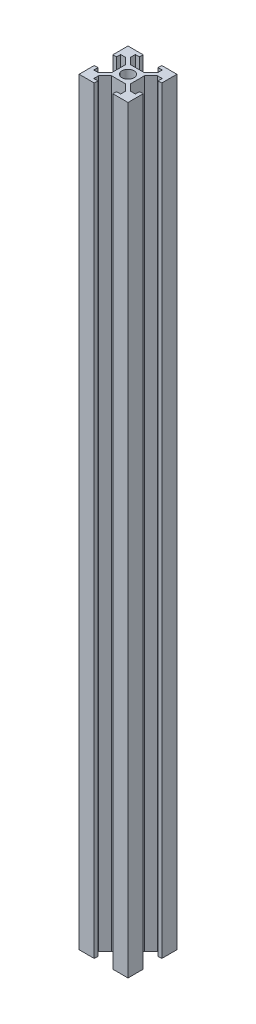
from build123d import *

# Parameters (mm, degrees)
SKETCH_1_W      = 1.5
SKETCH_1_H      = 1.7
SKETCH_1_W_2    = 1.7
SKETCH_1_H_2    = 1.5
SKETCH_1_W_3    = 7.8
SKETCH_1_H_3    = 7.8
SKETCH_1_R      = 2.5
EXTRUDE_1_DEPTH = 310


with BuildPart() as part:
    # 草图1 → 凸台-拉伸1 (new body)
    # profile 1 of 17: a face of its own
    with BuildSketch(Plane(origin=(0, 0, 0), x_dir=(1, 0, 0), z_dir=(0, 1, 0))):
        Polygon((5.5, 8.5), (5.5, 6.560660172), (5.5, 5.5), (6.560660172, 5.5), (8.5, 5.5), (10, 5.5), (10, 10), (5.5, 10), align=None)
    # profile 2 of 17: a face of its own
    with BuildSketch(Plane(origin=(0, 0, 0), x_dir=(1, 0, 0), z_dir=(0, 1, 0))):
        with Locations((9.25, 4.65)):
            Rectangle(SKETCH_1_W, SKETCH_1_H)
    # profile 3 of 17: a face of its own
    with BuildSketch(Plane(origin=(0, 0, 0), x_dir=(1, 0, 0), z_dir=(0, 1, 0))):
        Polygon((5.5, 6.560660172), (2.839339828, 3.9), (3.9, 3.9), (3.9, 2.839339828), (6.560660172, 5.5), (5.5, 5.5), align=None)
    # profile 4 of 17: a face of its own
    with BuildSketch(Plane(origin=(0, 0, 0), x_dir=(1, 0, 0), z_dir=(0, 1, 0))):
        with Locations((4.65, 9.25)):
            Rectangle(SKETCH_1_W_2, SKETCH_1_H_2)
    # profile 5 of 17: a face of its own
    with BuildSketch(Plane(origin=(0, 0, 0), x_dir=(1, 0, 0), z_dir=(0, 1, 0))):
        Rectangle(SKETCH_1_W_3, SKETCH_1_H_3)
        with Locations(Location((0, 0, 0), (0, 0, 270))):
            Circle(SKETCH_1_R, mode=Mode.SUBTRACT)
    # profile 6 of 17: a face of its own
    with BuildSketch(Plane(origin=(0, 0, 0), x_dir=(1, 0, 0), z_dir=(0, 1, 0))):
        with Locations((-4.65, 9.25)):
            Rectangle(SKETCH_1_W_2, SKETCH_1_H_2)
    # profile 7 of 17: a face of its own
    with BuildSketch(Plane(origin=(0, 0, 0), x_dir=(1, 0, 0), z_dir=(0, 1, 0))):
        Polygon((-8.5, 5.5), (-6.560660172, 5.5), (-5.5, 5.5), (-5.5, 6.560660172), (-5.5, 8.5), (-5.5, 10), (-10, 10), (-10, 5.5), align=None)
    # profile 8 of 17: a face of its own
    with BuildSketch(Plane(origin=(0, 0, 0), x_dir=(1, 0, 0), z_dir=(0, 1, 0))):
        with Locations((-9.25, 4.65)):
            Rectangle(SKETCH_1_W, SKETCH_1_H)
    # profile 9 of 17: a face of its own
    with BuildSketch(Plane(origin=(0, 0, 0), x_dir=(1, 0, 0), z_dir=(0, 1, 0))):
        Polygon((-5.5, 5.5), (-6.560660172, 5.5), (-3.9, 2.839339828), (-3.9, 3.9), (-2.839339828, 3.9), (-5.5, 6.560660172), align=None)
    # profile 10 of 17: a face of its own
    with BuildSketch(Plane(origin=(0, 0, 0), x_dir=(1, 0, 0), z_dir=(0, 1, 0))):
        Polygon((-5.5, -5.5), (-6.560660172, -5.5), (-8.5, -5.5), (-10, -5.5), (-10, -10), (-5.5, -10), (-5.5, -8.5), (-5.5, -6.560660172), align=None)
    # profile 11 of 17: a face of its own
    with BuildSketch(Plane(origin=(0, 0, 0), x_dir=(1, 0, 0), z_dir=(0, 1, 0))):
        with Locations((-4.65, -9.25)):
            Rectangle(SKETCH_1_W_2, SKETCH_1_H_2)
    # profile 12 of 17: a face of its own
    with BuildSketch(Plane(origin=(0, 0, 0), x_dir=(1, 0, 0), z_dir=(0, 1, 0))):
        with Locations((-9.25, -4.65)):
            Rectangle(SKETCH_1_W, SKETCH_1_H)
    # profile 13 of 17: a face of its own
    with BuildSketch(Plane(origin=(0, 0, 0), x_dir=(1, 0, 0), z_dir=(0, 1, 0))):
        Polygon((-3.9, -3.9), (-3.9, -2.839339828), (-6.560660172, -5.5), (-5.5, -5.5), (-5.5, -6.560660172), (-2.839339828, -3.9), align=None)
    # profile 14 of 17: a face of its own
    with BuildSketch(Plane(origin=(0, 0, 0), x_dir=(1, 0, 0), z_dir=(0, 1, 0))):
        Polygon((3.9, -3.9), (2.839339828, -3.9), (5.5, -6.560660172), (5.5, -5.5), (6.560660172, -5.5), (3.9, -2.839339828), align=None)
    # profile 15 of 17: a face of its own
    with BuildSketch(Plane(origin=(0, 0, 0), x_dir=(1, 0, 0), z_dir=(0, 1, 0))):
        Polygon((5.5, -5.5), (5.5, -6.560660172), (5.5, -8.5), (5.5, -10), (10, -10), (10, -5.5), (8.5, -5.5), (6.560660172, -5.5), align=None)
    # profile 16 of 17: a face of its own
    with BuildSketch(Plane(origin=(0, 0, 0), x_dir=(1, 0, 0), z_dir=(0, 1, 0))):
        with Locations((9.25, -4.65)):
            Rectangle(SKETCH_1_W, SKETCH_1_H)
    # profile 17 of 17: a face of its own
    with BuildSketch(Plane(origin=(0, 0, 0), x_dir=(1, 0, 0), z_dir=(0, 1, 0))):
        with Locations((4.65, -9.25)):
            Rectangle(SKETCH_1_W_2, SKETCH_1_H_2)
    extrude(amount=EXTRUDE_1_DEPTH)


solid = part.part
